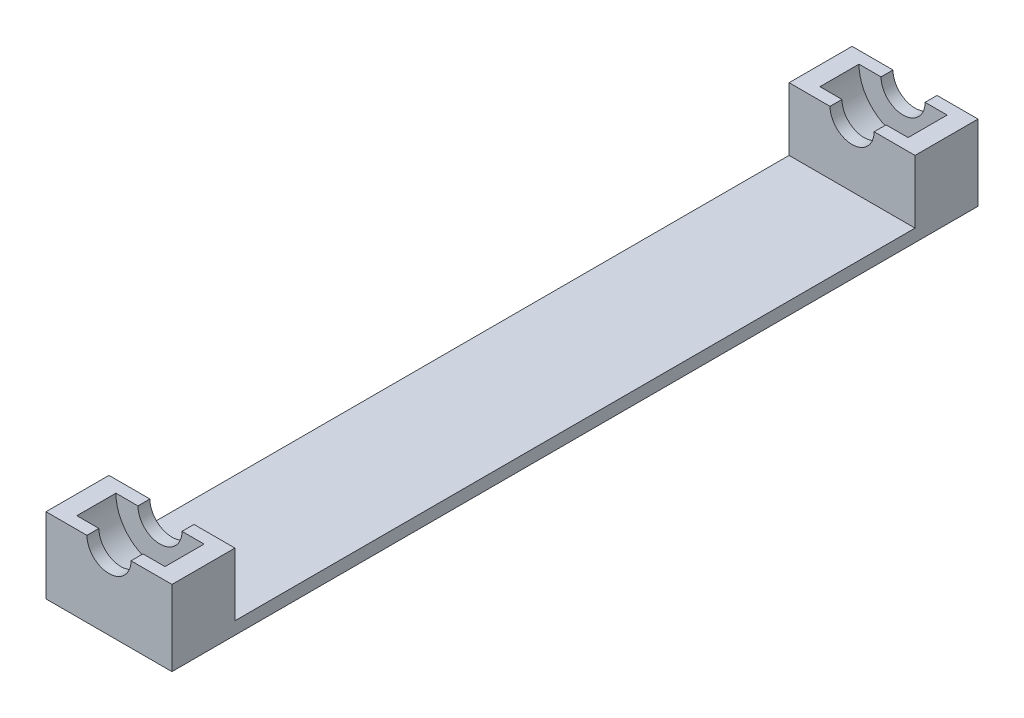
from build123d import *

# Parameters (mm, degrees)
BOSS_EXTRUDE1_DEPTH = 10
SKETCH2_R           = 3.5
SKETCH2_R_2         = 1.75
CUT_EXTRUDE1_DEPTH  = 1.55
SKETCH2_2_R         = 1.75
CUT_EXTRUDE2_DEPTH  = 6.6


with BuildPart() as part:
    # Sketch1 → Boss-Extrude1 (new body)
    with BuildSketch(Plane(origin=(0, 0, 0), x_dir=(0, 0, -1), z_dir=(1, 0, 0))):
        Polygon((-32, 5.5), (-32, -0.5), (32, -0.5), (32, 5.5), (27, 5.5), (27, 0.5), (-27, 0.5), (-27, 5.5), align=None)
    extrude(amount=BOSS_EXTRUDE1_DEPTH)

    # Sketch2 → Cut-Extrude1 (cut, symmetric)
    with BuildSketch(Plane.XY.offset(29.5)):
        with Locations((5, 5.5)):
            Circle(SKETCH2_R)
        with Locations((5, 5.5)):
            Circle(SKETCH2_R_2, mode=Mode.SUBTRACT)
    cut_extrude1 = extrude(amount=CUT_EXTRUDE1_DEPTH, both=True, mode=Mode.SUBTRACT)

    # Sketch2<2> → Cut-Extrude2 (cut, symmetric)
    with BuildSketch(Plane.XY.offset(29.5)):
        with Locations((5, 5.5)):
            Circle(SKETCH2_2_R)
    cut_extrude2 = extrude(amount=CUT_EXTRUDE2_DEPTH, both=True, mode=Mode.SUBTRACT)

    # Mirror1: Cut-Extrude1 across plane
    add(cut_extrude1.mirror(Plane.XY), mode=Mode.SUBTRACT)

    # Mirror2: Cut-Extrude2 across plane
    add(cut_extrude2.mirror(Plane.XY), mode=Mode.SUBTRACT)


solid = part.part
